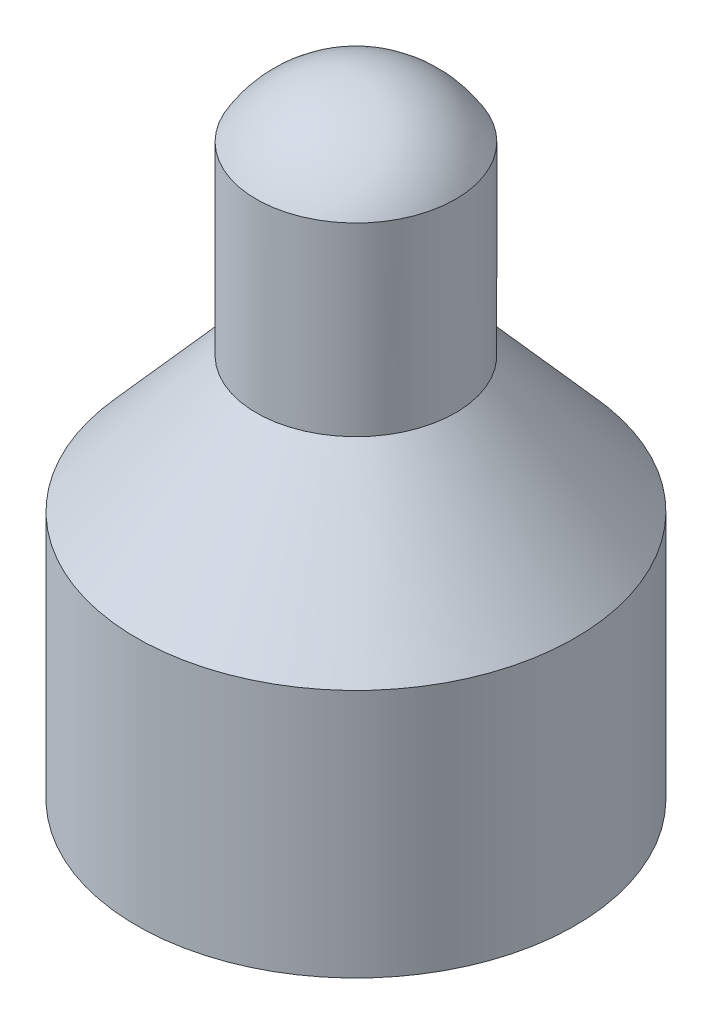
from build123d import *

# Parameters (mm, degrees)
ESQUISSE2_R             = 1.65
ENL_V_MAT_EXTRU_1_DEPTH = 50.09500993
ESQUISSE3_R             = 3.35
ENL_V_MAT_EXTRU_2_DEPTH = 56.81800793


with BuildPart() as part:
    # Esquisse1 → Révolution1 (revolve)
    with BuildSketch(Plane.XY, mode=Mode.PRIVATE) as r_volution1_sk:
        with BuildLine():
            Line((12.5, 0), (15.4, 0))
            Line((15.4, 0), (15.4, 17.5))
            Line((15.4, 17.5), (7, 27))
            Line((7, 27), (7, 40))
            ThreePointArc((7, 40), (4.031128874, 42.92947553), (0, 44))
            Line((0, 44), (0, 24))
            Line((0, 24), (5.443157895, 24))
            Line((5.443157895, 24), (11.5, 17.15))
            Line((11.5, 17.15), (12.5, 17.15))
            Line((12.5, 17.15), (12.5, 0))
        make_face()
    revolve(r_volution1_sk.sketch.rotate(Axis((0, 0, 0), (0, 1, 0)), 90), axis=Axis((0, 0, 0), (0, 1, 0)))

    # Esquisse2 → Enlèv. mat.-Extru.1 (cut, through all)
    with BuildSketch(Plane.XY):
        with Locations(Location((0, 9, 0), (0, 0, 90))):
            Circle(ESQUISSE2_R)
    extrude(amount=-ENL_V_MAT_EXTRU_1_DEPTH, mode=Mode.SUBTRACT)

    # Esquisse3 → Enlèv. mat.-Extru.2 (cut, through all)
    with BuildSketch(Plane.XY.offset(-15.3)):
        with Locations((0, 9)):
            Circle(ESQUISSE3_R)
    extrude(amount=-ENL_V_MAT_EXTRU_2_DEPTH, mode=Mode.SUBTRACT)


solid = part.part
